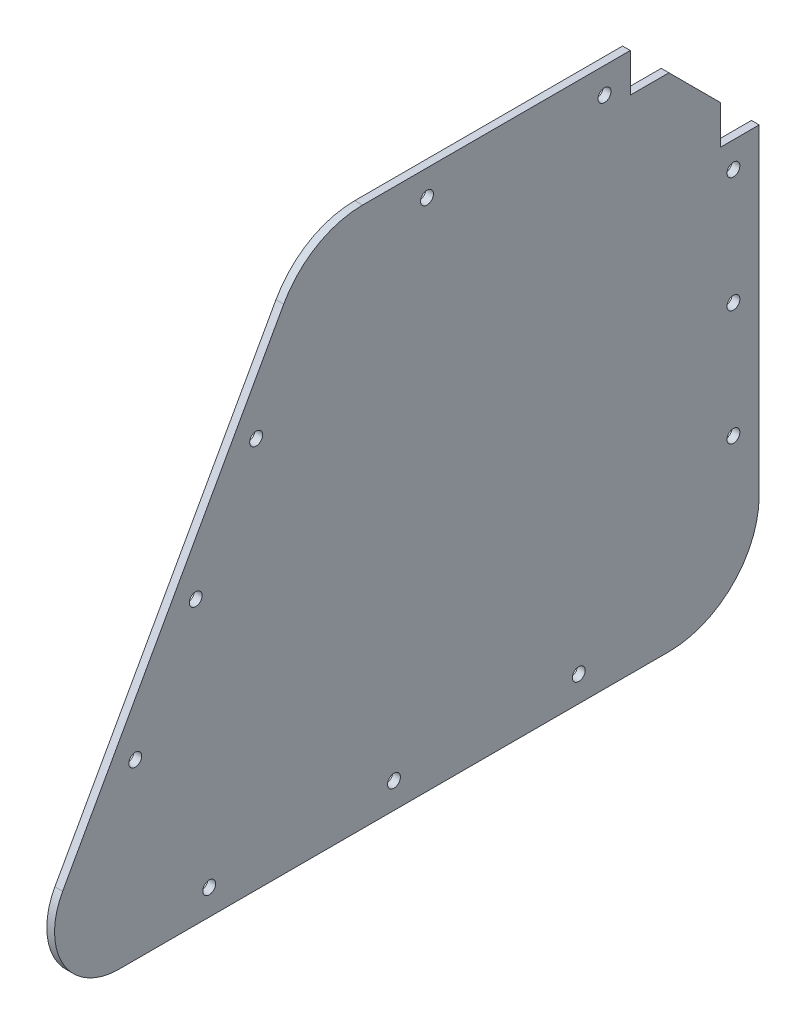
from build123d import *

# Parameters (mm, degrees)
BOSS_EXTRUDE1_DEPTH = 3
CUT_EXTRUDE1_REACH  = 242.652
SKETCH2_R           = 2.5
CUT_EXTRUDE2_REACH  = 242.652
CUT_EXTRUDE3_REACH  = 242.652


with BuildPart() as part:
    # Sketch1 → Boss-Extrude1 (new body)
    with BuildSketch(Plane(origin=(0, 0, 0), x_dir=(0, 0, -1), z_dir=(1, 0, 0))):
        with BuildLine():
            Line((-12.188515962, 194.5), (106.683660563, 194.5))
            ThreePointArc((106.683660563, 194.5), (131.432397904, 184.248737342), (141.683660563, 159.5))
            Line((141.683660563, 159.5), (141.683660563, 20))
            ThreePointArc((141.683660563, 20), (131.432397904, -4.748737342), (106.683660563, -15))
            Line((106.683660563, -15), (-106.683660563, -15))
            ThreePointArc((-106.683660563, -15), (-128.230433314, -2.678193247), (-128.537592466, 22.141073279))
            Line((-128.537592466, 22.141073279), (-42.784020626, 176.497502591))
            ThreePointArc((-42.784020626, 176.497502591), (-29.937986507, 189.665481852), (-12.188515962, 194.5))
        make_face()
    extrude(amount=BOSS_EXTRUDE1_DEPTH)

    # Sketch2 → Cut-Extrude1 (cut, up to next)
    with BuildSketch(Plane(origin=(3, 0, 0), x_dir=(0, 0, -1), z_dir=(1, 0, 0)), mode=Mode.PRIVATE) as cut_extrude1_sk1:
        with Locations((81.683660563, 184.5)):
            Circle(SKETCH2_R)
    cut_extrude1_tool1 = extrude(cut_extrude1_sk1.sketch, amount=-CUT_EXTRUDE1_REACH, mode=Mode.PRIVATE) & part.part
    # Sketch2 → Cut-Extrude1 (cut, up to next)
    with BuildSketch(Plane(origin=(3, 0, 0), x_dir=(0, 0, -1), z_dir=(1, 0, 0)), mode=Mode.PRIVATE) as cut_extrude1_sk2:
        with Locations((12.811484038, 184.5)):
            Circle(SKETCH2_R)
    cut_extrude1_tool2 = extrude(cut_extrude1_sk2.sketch, amount=-CUT_EXTRUDE1_REACH, mode=Mode.PRIVATE) & part.part
    # Sketch2 → Cut-Extrude1 (cut, up to next)
    with BuildSketch(Plane(origin=(3, 0, 0), x_dir=(0, 0, -1), z_dir=(1, 0, 0)), mode=Mode.PRIVATE) as cut_extrude1_sk3:
        with Locations((131.683660563, 134.49995686)):
            Circle(SKETCH2_R)
    cut_extrude1_tool3 = extrude(cut_extrude1_sk3.sketch, amount=-CUT_EXTRUDE1_REACH, mode=Mode.PRIVATE) & part.part
    # Sketch2 → Cut-Extrude1 (cut, up to next)
    with BuildSketch(Plane(origin=(3, 0, 0), x_dir=(0, 0, -1), z_dir=(1, 0, 0)), mode=Mode.PRIVATE) as cut_extrude1_sk4:
        with Locations((131.683660563, 89.75)):
            Circle(SKETCH2_R)
    cut_extrude1_tool4 = extrude(cut_extrude1_sk4.sketch, amount=-CUT_EXTRUDE1_REACH, mode=Mode.PRIVATE) & part.part
    # Sketch2 → Cut-Extrude1 (cut, up to next)
    with BuildSketch(Plane(origin=(3, 0, 0), x_dir=(0, 0, -1), z_dir=(1, 0, 0)), mode=Mode.PRIVATE) as cut_extrude1_sk5:
        with Locations((131.683660563, 44.999939605)):
            Circle(SKETCH2_R)
    cut_extrude1_tool5 = extrude(cut_extrude1_sk5.sketch, amount=-CUT_EXTRUDE1_REACH, mode=Mode.PRIVATE) & part.part
    # Sketch2 → Cut-Extrude1 (cut, up to next)
    with BuildSketch(Plane(origin=(3, 0, 0), x_dir=(0, 0, -1), z_dir=(1, 0, 0)), mode=Mode.PRIVATE) as cut_extrude1_sk6:
        with Locations((71.683660563, -5)):
            Circle(SKETCH2_R)
    cut_extrude1_tool6 = extrude(cut_extrude1_sk6.sketch, amount=-CUT_EXTRUDE1_REACH, mode=Mode.PRIVATE) & part.part
    # Sketch2 → Cut-Extrude1 (cut, up to next)
    with BuildSketch(Plane(origin=(3, 0, 0), x_dir=(0, 0, -1), z_dir=(1, 0, 0)), mode=Mode.PRIVATE) as cut_extrude1_sk7:
        with Locations((0, -5)):
            Circle(SKETCH2_R)
    cut_extrude1_tool7 = extrude(cut_extrude1_sk7.sketch, amount=-CUT_EXTRUDE1_REACH, mode=Mode.PRIVATE) & part.part
    # Sketch2 → Cut-Extrude1 (cut, up to next)
    with BuildSketch(Plane(origin=(3, 0, 0), x_dir=(0, 0, -1), z_dir=(1, 0, 0)), mode=Mode.PRIVATE) as cut_extrude1_sk8:
        with Locations((-71.683660563, -5)):
            Circle(SKETCH2_R)
    cut_extrude1_tool8 = extrude(cut_extrude1_sk8.sketch, amount=-CUT_EXTRUDE1_REACH, mode=Mode.PRIVATE) & part.part
    # Sketch2 → Cut-Extrude1 (cut, up to next)
    with BuildSketch(Plane(origin=(3, 0, 0), x_dir=(0, 0, -1), z_dir=(1, 0, 0)), mode=Mode.PRIVATE) as cut_extrude1_sk9:
        with Locations((-100.370302458, 52.250935013)):
            Circle(SKETCH2_R)
    cut_extrude1_tool9 = extrude(cut_extrude1_sk9.sketch, amount=-CUT_EXTRUDE1_REACH, mode=Mode.PRIVATE) & part.part
    # Sketch2 → Cut-Extrude1 (cut, up to next)
    with BuildSketch(Plane(origin=(3, 0, 0), x_dir=(0, 0, -1), z_dir=(1, 0, 0)), mode=Mode.PRIVATE) as cut_extrude1_sk10:
        with Locations((-76.919233785, 94.462858624)):
            Circle(SKETCH2_R)
    cut_extrude1_tool10 = extrude(cut_extrude1_sk10.sketch, amount=-CUT_EXTRUDE1_REACH, mode=Mode.PRIVATE) & part.part
    # Sketch2 → Cut-Extrude1 (cut, up to next)
    with BuildSketch(Plane(origin=(3, 0, 0), x_dir=(0, 0, -1), z_dir=(1, 0, 0)), mode=Mode.PRIVATE) as cut_extrude1_sk11:
        with Locations((-53.468165112, 136.674782235)):
            Circle(SKETCH2_R)
    cut_extrude1_tool11 = extrude(cut_extrude1_sk11.sketch, amount=-CUT_EXTRUDE1_REACH, mode=Mode.PRIVATE) & part.part
    add(cut_extrude1_tool1.solids().sort_by_distance((3, 184.5, -81.683661))[0], mode=Mode.SUBTRACT)
    add(cut_extrude1_tool2.solids().sort_by_distance((3, 184.5, -12.811484))[0], mode=Mode.SUBTRACT)
    add(cut_extrude1_tool3.solids().sort_by_distance((3, 134.499957, -131.683661))[0], mode=Mode.SUBTRACT)
    add(cut_extrude1_tool4.solids().sort_by_distance((3, 89.75, -131.683661))[0], mode=Mode.SUBTRACT)
    add(cut_extrude1_tool5.solids().sort_by_distance((3, 44.99994, -131.683661))[0], mode=Mode.SUBTRACT)
    add(cut_extrude1_tool6.solids().sort_by_distance((3, -5, -71.683661))[0], mode=Mode.SUBTRACT)
    add(cut_extrude1_tool7.solids().sort_by_distance((3, -5, 0))[0], mode=Mode.SUBTRACT)
    add(cut_extrude1_tool8.solids().sort_by_distance((3, -5, 71.683661))[0], mode=Mode.SUBTRACT)
    add(cut_extrude1_tool9.solids().sort_by_distance((3, 52.250935, 100.370302))[0], mode=Mode.SUBTRACT)
    add(cut_extrude1_tool10.solids().sort_by_distance((3, 94.462859, 76.919234))[0], mode=Mode.SUBTRACT)
    add(cut_extrude1_tool11.solids().sort_by_distance((3, 136.674782, 53.468165))[0], mode=Mode.SUBTRACT)

    # Sketch4 → Cut-Extrude2 (cut, up to next)
    with BuildSketch(Plane(origin=(3, 0, 0), x_dir=(0, 0, -1), z_dir=(1, 0, 0)), mode=Mode.PRIVATE) as cut_extrude2_sk1:
        with BuildLine():
            Line((141.683660563, 144.5), (126.683660563, 144.5))
            Line((126.683660563, 144.5), (126.683660563, 159.5))
            ThreePointArc((126.683660563, 159.5), (120.825796187, 173.642135624), (106.683660563, 179.5))
            Line((106.683660563, 179.5), (91.683660563, 179.5))
            Line((91.683660563, 179.5), (91.683660563, 194.5))
            Line((91.683660563, 194.5), (141.683660563, 194.5))
            Line((141.683660563, 194.5), (141.683660563, 144.5))
        make_face()
    cut_extrude2_tool1 = extrude(cut_extrude2_sk1.sketch, amount=-CUT_EXTRUDE2_REACH, mode=Mode.PRIVATE) & part.part
    add(cut_extrude2_tool1.solids().sort_by_distance((3, 176.600336, -123.783996))[0], mode=Mode.SUBTRACT)

    # Sketch5 → Cut-Extrude3 (cut, up to next)
    with BuildSketch(Plane(origin=(3, 0, 0), x_dir=(0, 0, -1), z_dir=(1, 0, 0)), mode=Mode.PRIVATE) as cut_extrude3_sk1:
        with BuildLine():
            Line((106.683660563, 179.5), (126.683660563, 159.5))
            ThreePointArc((126.683660563, 159.5), (120.825796187, 173.642135624), (106.683660563, 179.5))
        make_face()
    cut_extrude3_tool1 = extrude(cut_extrude3_sk1.sketch, amount=-CUT_EXTRUDE3_REACH, mode=Mode.PRIVATE) & part.part
    add(cut_extrude3_tool1.solids().sort_by_distance((3, 171.179589, -118.36325))[0], mode=Mode.SUBTRACT)


solid = part.part
